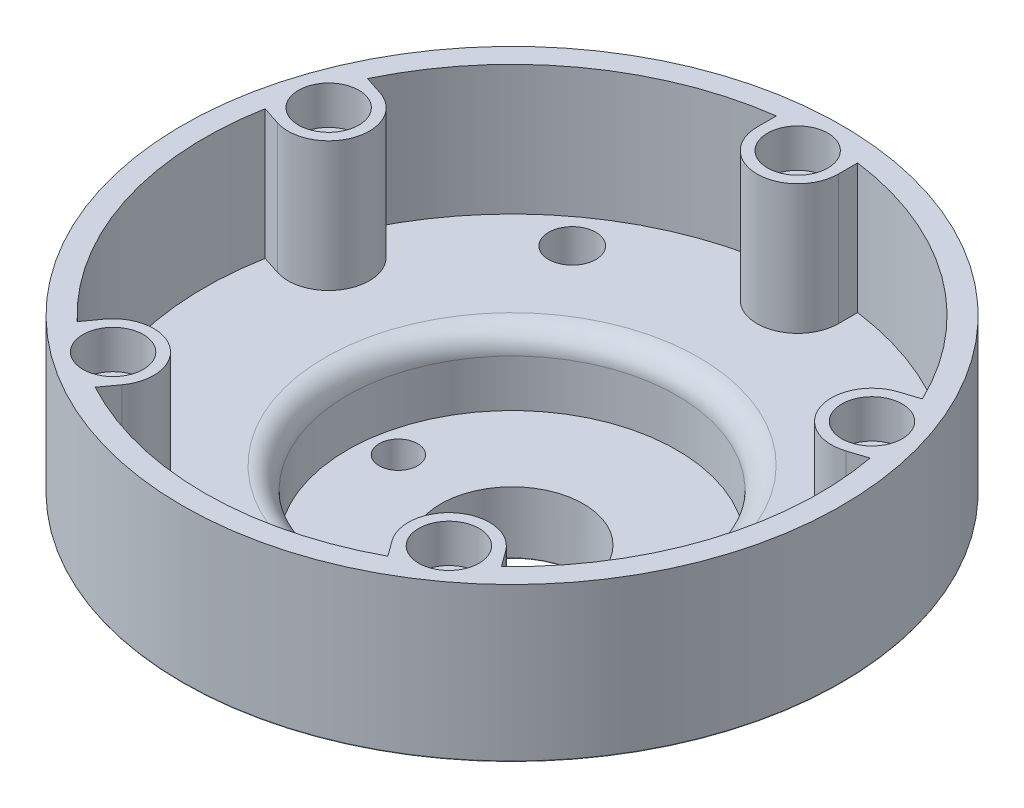
from build123d import *

# Parameters (mm, degrees)
SKETCH1_R           = 30
BOSS_EXTRUDE1_DEPTH = 14
SKETCH2_R           = 16.125
BOSS_EXTRUDE2_DEPTH = 9.8
CUT_EXTRUDE1_DEPTH  = 11.8
SKETCH4_R           = 15
CUT_EXTRUDE2_DEPTH  = 6.3
SKETCH5_R           = 6.5
CUT_EXTRUDE3_DEPTH  = 8.3
SKETCH6_R           = 2.75
CUT_EXTRUDE4_DEPTH  = 3.5
SKETCH7_R           = 1.25
CUT_EXTRUDE5_DEPTH  = 48.032860853
SKETCH8_R           = 1.75
CUT_EXTRUDE6_DEPTH  = 47.126023024
SKETCH10_R          = 3.25
BOSS_EXTRUDE3_DEPTH = 9.8
SKETCH11_R          = 2.15
CUT_EXTRUDE7_DEPTH  = 49.6460687
FILLET1_R           = 2
CHAMFER1_SIZE       = 1
FILLET2_R           = 0.1
FILLET3_R           = 0.4
FILLET4_R           = 1


with BuildPart() as part:
    # Sketch1 → Boss-Extrude1 (new body)
    with BuildSketch(Plane(origin=(0, 0, 0), x_dir=(1, 0, 0), z_dir=(0, 1, 0))):
        with Locations(Location((0, 0, 0), (0, 0, 270))):
            Circle(SKETCH1_R)
    extrude(amount=BOSS_EXTRUDE1_DEPTH)

    # Sketch2 → Boss-Extrude2 (add)
    with BuildSketch(Plane.XZ):
        with Locations(Location((0, 0, 0), (0, 0, 270))):
            Circle(SKETCH2_R)
    extrude(amount=BOSS_EXTRUDE2_DEPTH)

    # Sketch3 → Cut-Extrude1 (cut)
    with BuildSketch(Plane(origin=(0, 14, 0), x_dir=(1, 0, 0), z_dir=(0, 1, 0))):
        with BuildLine():
            Line((-3.7, 26), (-3.7, 27.754459101))
            ThreePointArc((-3.7, 27.754459101), (-16.457987064, 22.652475842), (-25.252696305, 12.095508642))
            Line((-25.252696305, 12.095508642), (-23.584106544, 11.553350964))
            ThreePointArc((-23.584106544, 11.553350964), (-21.208560313, 6.891078975), (-25.870832303, 4.515532743))
            Line((-25.870832303, 4.515532743), (-27.539422064, 5.057690422))
            ThreePointArc((-27.539422064, 5.057690422), (-26.629582456, -8.652475842), (-19.307024624, -20.279023649))
            Line((-19.307024624, -20.279023649), (-18.275779439, -18.85963642))
            ThreePointArc((-18.275779439, -18.85963642), (-13.107611126, -18.041078975), (-12.28905368, -23.209247287))
            Line((-12.28905368, -23.209247287), (-13.320298866, -24.628634516))
            ThreePointArc((-13.320298866, -24.628634516), (0, -28), (13.320298866, -24.628634516))
            Line((13.320298866, -24.628634516), (12.28905368, -23.209247287))
            ThreePointArc((12.28905368, -23.209247287), (13.107611126, -18.041078975), (18.275779439, -18.85963642))
            Line((18.275779439, -18.85963642), (19.307024624, -20.279023649))
            ThreePointArc((19.307024624, -20.279023649), (26.629582456, -8.652475842), (27.539422064, 5.057690422))
            Line((27.539422064, 5.057690422), (25.870832303, 4.515532743))
            ThreePointArc((25.870832303, 4.515532743), (21.208560313, 6.891078975), (23.584106544, 11.553350964))
            Line((23.584106544, 11.553350964), (25.252696305, 12.095508642))
            ThreePointArc((25.252696305, 12.095508642), (16.457987064, 22.652475842), (3.7, 27.754459101))
            Line((3.7, 27.754459101), (3.7, 26))
            ThreePointArc((3.7, 26), (0, 22.3), (-3.7, 26))
        make_face()
    extrude(amount=-CUT_EXTRUDE1_DEPTH, mode=Mode.SUBTRACT)

    # Sketch4 → Cut-Extrude2 (cut)
    with BuildSketch(Plane(origin=(0, 2.2, 0), x_dir=(1, 0, 0), z_dir=(0, 1, 0))):
        with Locations(Location((0, 0, 0), (0, 0, 270))):
            Circle(SKETCH4_R)
    extrude(amount=-CUT_EXTRUDE2_DEPTH, mode=Mode.SUBTRACT)

    # Sketch5 → Cut-Extrude3 (cut)
    with BuildSketch(Plane(origin=(0, -4.1, 0), x_dir=(1, 0, 0), z_dir=(0, 1, 0))):
        with Locations(Location((0, 0, 0), (0, 0, 270))):
            Circle(SKETCH5_R)
    extrude(amount=-CUT_EXTRUDE3_DEPTH, mode=Mode.SUBTRACT)

    # Sketch6 → Cut-Extrude4 (cut)
    with BuildSketch(Plane(origin=(0, 14, 0), x_dir=(1, 0, 0), z_dir=(0, 1, 0))):
        with Locations(Location((0, 26, 0), (0, 0, 270))):
            Circle(SKETCH6_R)
        with Locations(Location((24.727469424, 8.034441854, 0), (0, 0, 270))):
            Circle(SKETCH6_R)
        with Locations(Location((15.28241656, -21.034441854, 0), (0, 0, 270))):
            Circle(SKETCH6_R)
        with Locations(Location((-15.28241656, -21.034441854, 0), (0, 0, 270))):
            Circle(SKETCH6_R)
        with Locations(Location((-24.727469424, 8.034441854, 0), (0, 0, 270))):
            Circle(SKETCH6_R)
    extrude(amount=-CUT_EXTRUDE4_DEPTH, mode=Mode.SUBTRACT)

    # Sketch7 → Cut-Extrude5 (cut, through all)
    with BuildSketch(Plane(origin=(0, 10.5, 0), x_dir=(1, 0, 0), z_dir=(0, 1, 0))):
        with Locations(Location((15.28241656, -21.034441854, 0), (0, 0, 270))):
            Circle(SKETCH7_R)
        with Locations(Location((-15.28241656, -21.034441854, 0), (0, 0, 270))):
            Circle(SKETCH7_R)
        with Locations(Location((-24.727469424, 8.034441854, 0), (0, 0, 270))):
            Circle(SKETCH7_R)
        with Locations(Location((0, 26, 0), (0, 0, 270))):
            Circle(SKETCH7_R)
        with Locations(Location((24.727469424, 8.034441854, 0), (0, 0, 270))):
            Circle(SKETCH7_R)
    extrude(amount=-CUT_EXTRUDE5_DEPTH, mode=Mode.SUBTRACT)

    # Sketch8 → Cut-Extrude6 (cut, through all)
    with BuildSketch(Plane(origin=(0, -4.1, 0), x_dir=(1, 0, 0), z_dir=(0, 1, 0))):
        with Locations(Location((-12.29671984, 1.94760909, 0), (0, 0, 270))):
            Circle(SKETCH8_R)
        with Locations(Location((12.29671984, -1.94760909, 0), (0, 0, 270))):
            Circle(SKETCH8_R)
    extrude(amount=-CUT_EXTRUDE6_DEPTH, mode=Mode.SUBTRACT)

    # Sketch10 → Boss-Extrude3 (add)
    with BuildSketch(Plane.XZ):
        with Locations(Location((-14.547684994, -20.023170611, 0), (0, 0, 90))):
            Circle(SKETCH10_R)
    extrude(amount=BOSS_EXTRUDE3_DEPTH)

    # Sketch11 → Cut-Extrude7 (cut, through all)
    with BuildSketch(Plane.XZ.offset(9.8)):
        with Locations(Location((-14.547684994, -20.023170611, 0), (0, 0, 270))):
            Circle(SKETCH11_R)
    extrude(amount=-CUT_EXTRUDE7_DEPTH, mode=Mode.SUBTRACT)

    # Fillet1
    fillet1_edges = [part.edges().sort_by_distance(p)[0] for p in [
        (0, 2.2, -15),
    ]]
    fillet(fillet1_edges, radius=FILLET1_R)

    # Chamfer1
    chamfer1_edges = [part.edges().sort_by_distance(p)[0] for p in [
        (-14.547684994, 0, -23.273170611),
    ]]
    chamfer(chamfer1_edges, length=CHAMFER1_SIZE)

    # Fillet2
    fillet2_edges = [part.edges().sort_by_distance(p)[0] for p in [
        (0, 0, -30),
        (0, -9.8, 16.125),
        (0, -9.8, -6.5),
    ]]
    fillet(fillet2_edges, radius=FILLET2_R)

    # Fillet3
    fillet3_edges = [part.edges().sort_by_distance(p)[0] for p in [
        (-14.547684994, -9.8, -23.273170611),
        (-14.547684994, -9.8, -17.873170611),
    ]]
    fillet(fillet3_edges, radius=FILLET3_R)

    # Fillet4
    fillet4_edges = [part.edges().sort_by_distance(p)[0] for p in [
        (0, 0, 16.125),
    ]]
    fillet(fillet4_edges, radius=FILLET4_R)


solid = part.part
